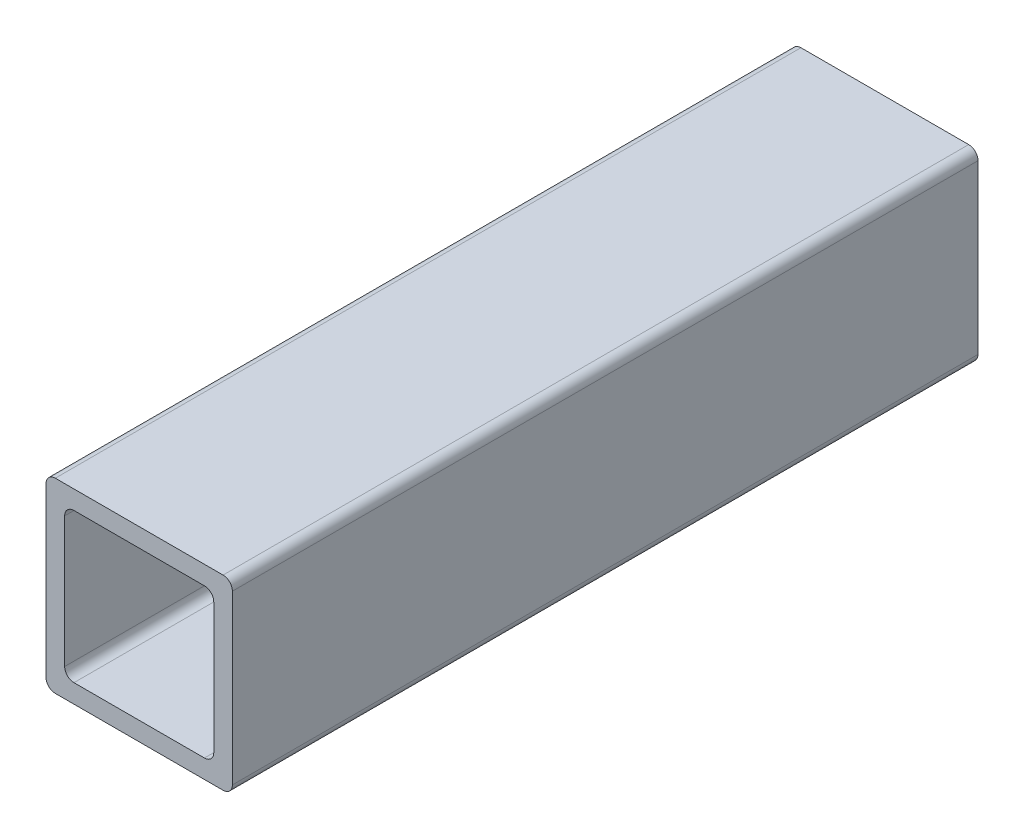
from build123d import *

# Parameters (mm, degrees)
SKETCH1_W           = 25.4
SKETCH1_H           = 25.4
SKETCH1_W_2         = 20.32
SKETCH1_H_2         = 20.32
BOSS_EXTRUDE1_DEPTH = 101.6
FILLET1_R           = 1.27


with BuildPart() as part:
    # Sketch1 → Boss-Extrude1 (new body)
    with BuildSketch(Plane.XY):
        with Locations((-12.7, 12.7)):
            Rectangle(SKETCH1_W, SKETCH1_H)
        with Locations((-12.7, 12.7)):
            Rectangle(SKETCH1_W_2, SKETCH1_H_2, mode=Mode.SUBTRACT)
    extrude(amount=BOSS_EXTRUDE1_DEPTH)

    # Fillet1
    fillet1_edges = [part.edges().sort_by_distance(p)[0] for p in [
        (-22.86, 22.86, 50.8),
        (-22.86, 2.54, 50.8),
        (-2.54, 2.54, 50.8),
        (-2.54, 22.86, 50.8),
        (0, 0, 50.8),
        (-25.4, 0, 50.8),
        (-25.4, 25.4, 50.8),
        (0, 25.4, 50.8),
    ]]
    fillet(fillet1_edges, radius=FILLET1_R)


solid = part.part
